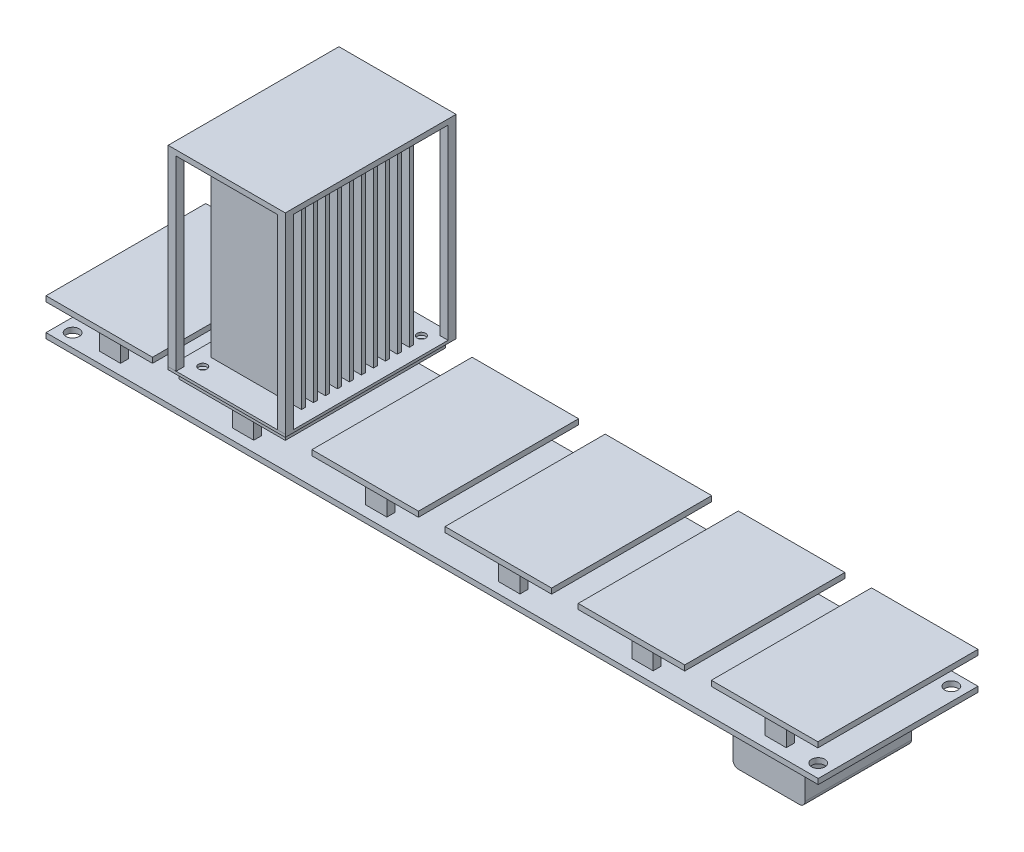
from build123d import *

# Parameters (mm, degrees)
SKIZZE1_W                        = 290
SKIZZE1_H                        = 2
AUFSATZ_LINEAR_AUSTRAGEN1_DEPTH  = 60
SKIZZE2_R                        = 2.5
SCHNITT_LINEAR_AUSTRAGEN1_DEPTH  = 60
SKIZZE3_W                        = 8
SKIZZE3_H                        = 3
AUFSATZ_LINEAR_AUSTRAGEN2_DEPTH  = 10
SKIZZE4_W                        = 40
SKIZZE4_H                        = 60
SKIZZE4_H_2                      = 60.133820733
AUFSATZ_LINEAR_AUSTRAGEN3_DEPTH  = 2
SKIZZE6_W                        = 40
SKIZZE6_H                        = 60.133820733
AUFSATZ_LINEAR_AUSTRAGEN4_DEPTH  = 2
SKIZZE7_W                        = 60.133820733
SKIZZE7_H                        = 2
AUFSATZ_LINEAR_AUSTRAGEN5_DEPTH  = 2
SKIZZE8_W                        = 60.133820733
SKIZZE8_H                        = 2
AUFSATZ_LINEAR_AUSTRAGEN6_DEPTH  = 2
SKIZZE9_W                        = 44
SKIZZE9_H                        = 2
AUFSATZ_LINEAR_AUSTRAGEN7_DEPTH  = 2
SKIZZE10_W                       = 44
SKIZZE10_H                       = 2
AUFSATZ_LINEAR_AUSTRAGEN8_DEPTH  = 2
SKIZZE11_W                       = 34
SKIZZE11_H                       = 1.5
AUFSATZ_LINEAR_AUSTRAGEN9_DEPTH  = 70
SKIZZE12_W                       = 44
SKIZZE12_H                       = 1
SCHNITT_LINEAR_AUSTRAGEN3_DEPTH  = 70
SKIZZE13_W                       = 44
SKIZZE13_H                       = 64.13
AUFSATZ_LINEAR_AUSTRAGEN10_DEPTH = 2
SKIZZE14_W                       = 3
SKIZZE14_H                       = 3
AUFSATZ_LINEAR_AUSTRAGEN11_DEPTH = 72
SKIZZE15_W                       = 27
SKIZZE15_H                       = 40
AUFSATZ_LINEAR_AUSTRAGEN12_DEPTH = 20
VERRUNDUNG2_R                    = 2
VERRUNDUNG3_R                    = 2
SKIZZE18_R                       = 1.6
SCHNITT_LINEAR_AUSTRAGEN4_DEPTH  = 10


with BuildPart() as part:
    # Skizze1 → Aufsatz-Linear austragen1 (new body)
    with BuildSketch(Plane.XY):
        with Locations((145, 1)):
            Rectangle(SKIZZE1_W, SKIZZE1_H)
    extrude(amount=AUFSATZ_LINEAR_AUSTRAGEN1_DEPTH)

    # Skizze2 → Schnitt-Linear austragen1 (cut)
    with BuildSketch(Plane(origin=(0, 2, 0), x_dir=(1, 0, 0), z_dir=(0, 1, 0))):
        with Locations(Location((5, -5, 0), (0, 0, 270))):
            Circle(SKIZZE2_R)
        with Locations(Location((5, -55, 0), (0, 0, 270))):
            Circle(SKIZZE2_R)
        with Locations(Location((285, -55, 0), (0, 0, 270))):
            Circle(SKIZZE2_R)
        with Locations(Location((285, -5, 0), (0, 0, 270))):
            Circle(SKIZZE2_R)
    extrude(amount=-SCHNITT_LINEAR_AUSTRAGEN1_DEPTH, mode=Mode.SUBTRACT)

    # Skizze3 → Aufsatz-Linear austragen2 (add)
    with BuildSketch(Plane(origin=(0, 2, 0), x_dir=(1, 0, 0), z_dir=(0, 1, 0))):
        with Locations((20, -6.5)):
            Rectangle(SKIZZE3_W, SKIZZE3_H)
        with Locations((70, -6.5)):
            Rectangle(SKIZZE3_W, SKIZZE3_H)
        with Locations((120, -6.5)):
            Rectangle(SKIZZE3_W, SKIZZE3_H)
        with Locations((170, -6.5)):
            Rectangle(SKIZZE3_W, SKIZZE3_H)
        with Locations((220, -6.5)):
            Rectangle(SKIZZE3_W, SKIZZE3_H)
        with Locations((270, -6.5)):
            Rectangle(SKIZZE3_W, SKIZZE3_H)
        with Locations((270, -54.5)):
            Rectangle(SKIZZE3_W, SKIZZE3_H)
        with Locations((220, -54.5)):
            Rectangle(SKIZZE3_W, SKIZZE3_H)
        with Locations((170, -54.5)):
            Rectangle(SKIZZE3_W, SKIZZE3_H)
        with Locations((120, -54.5)):
            Rectangle(SKIZZE3_W, SKIZZE3_H)
        with Locations((70, -54.5)):
            Rectangle(SKIZZE3_W, SKIZZE3_H)
        with Locations((20, -54.5)):
            Rectangle(SKIZZE3_W, SKIZZE3_H)
    extrude(amount=AUFSATZ_LINEAR_AUSTRAGEN2_DEPTH)

    # Skizze4 → Aufsatz-Linear austragen3 (add)
    with BuildSketch(Plane(origin=(0, 12, 0), x_dir=(1, 0, 0), z_dir=(0, 1, 0))):
        with Locations((20, -30)):
            Rectangle(SKIZZE4_W, SKIZZE4_H)
        with Locations((70, -30.066910367)):
            Rectangle(SKIZZE4_W, SKIZZE4_H_2)
        with Locations((120, -30.066910367)):
            Rectangle(SKIZZE4_W, SKIZZE4_H_2)
        with Locations((170, -30.066910367)):
            Rectangle(SKIZZE4_W, SKIZZE4_H_2)
        with Locations((220, -30.066910367)):
            Rectangle(SKIZZE4_W, SKIZZE4_H_2)
        with Locations((270, -30.066910367)):
            Rectangle(SKIZZE4_W, SKIZZE4_H_2)
    extrude(amount=AUFSATZ_LINEAR_AUSTRAGEN3_DEPTH)

    # Skizze6 → Aufsatz-Linear austragen4 (add)
    with BuildSketch(Plane(origin=(0, 14, 0), x_dir=(1, 0, 0), z_dir=(0, 1, 0))):
        with Locations((70, -30.066910367)):
            Rectangle(SKIZZE6_W, SKIZZE6_H)
    extrude(amount=AUFSATZ_LINEAR_AUSTRAGEN4_DEPTH)

    # Skizze7 → Aufsatz-Linear austragen5 (add)
    with BuildSketch(Plane(origin=(90, 0, 0), x_dir=(0, 0, -1), z_dir=(1, 0, 0))):
        with Locations((-30.066910367, 15)):
            Rectangle(SKIZZE7_W, SKIZZE7_H)
    extrude(amount=AUFSATZ_LINEAR_AUSTRAGEN5_DEPTH)

    # Skizze8 → Aufsatz-Linear austragen6 (add)
    with BuildSketch(Plane.ZY.offset(-50)):
        with Locations((30.066910367, 15)):
            Rectangle(SKIZZE8_W, SKIZZE8_H)
    extrude(amount=AUFSATZ_LINEAR_AUSTRAGEN6_DEPTH)

    # Skizze9 → Aufsatz-Linear austragen7 (add)
    with BuildSketch(Plane.XY.offset(60.133820733)):
        with Locations((70, 15)):
            Rectangle(SKIZZE9_W, SKIZZE9_H)
    extrude(amount=AUFSATZ_LINEAR_AUSTRAGEN7_DEPTH)

    # Skizze10 → Aufsatz-Linear austragen8 (add)
    with BuildSketch(Plane(origin=(0, 0, 0), x_dir=(-1, 0, 0), z_dir=(0, 0, -1))):
        with Locations((-70, 15)):
            Rectangle(SKIZZE10_W, SKIZZE10_H)
    extrude(amount=AUFSATZ_LINEAR_AUSTRAGEN8_DEPTH)

    # Skizze11 → Aufsatz-Linear austragen9 (add)
    with BuildSketch(Plane(origin=(0, 16, 0), x_dir=(1, 0, 0), z_dir=(0, 1, 0))):
        with Locations((70, -9.815)):
            Rectangle(SKIZZE11_W, SKIZZE11_H)
        with Locations((70, -14.315)):
            Rectangle(SKIZZE11_W, SKIZZE11_H)
        with Locations((70, -18.815)):
            Rectangle(SKIZZE11_W, SKIZZE11_H)
        with Locations((70, -23.315)):
            Rectangle(SKIZZE11_W, SKIZZE11_H)
        with Locations((70, -27.815)):
            Rectangle(SKIZZE11_W, SKIZZE11_H)
        with Locations((70, -32.315)):
            Rectangle(SKIZZE11_W, SKIZZE11_H)
        with Locations((70, -36.815)):
            Rectangle(SKIZZE11_W, SKIZZE11_H)
        with Locations((70, -41.315)):
            Rectangle(SKIZZE11_W, SKIZZE11_H)
        with Locations((70, -45.815)):
            Rectangle(SKIZZE11_W, SKIZZE11_H)
        with Locations((70, -50.315)):
            Rectangle(SKIZZE11_W, SKIZZE11_H)
    extrude(amount=AUFSATZ_LINEAR_AUSTRAGEN9_DEPTH)

    # Skizze12 → Schnitt-Linear austragen3 (cut)
    with BuildSketch(Plane.XY.offset(62.133820733)):
        with Locations((70, 14.5)):
            Rectangle(SKIZZE12_W, SKIZZE12_H)
    extrude(amount=-SCHNITT_LINEAR_AUSTRAGEN3_DEPTH, mode=Mode.SUBTRACT)


with BuildPart() as schnitt_linear_austragen3_piece_1:
    # of the separate pieces the step leaves, piece 1, a body of its own (schnitt_linear_austragen3_pieces)
    add(part.part.solids().sort_by_distance((0, 12, 0))[0])

    # Skizze15 → Aufsatz-Linear austragen12 (add)
    with BuildSketch(Plane.XZ):
        with Locations((261.5, 30)):
            Rectangle(SKIZZE15_W, SKIZZE15_H)
    extrude(amount=AUFSATZ_LINEAR_AUSTRAGEN12_DEPTH)

    # Verrundung2
    verrundung2_edges = [schnitt_linear_austragen3_piece_1.edges().sort_by_distance(p)[0] for p in [
        (275, -20, 30),
    ]]
    fillet(verrundung2_edges, radius=VERRUNDUNG2_R)

    # Verrundung3
    verrundung3_edges = [schnitt_linear_austragen3_piece_1.edges().sort_by_distance(p)[0] for p in [
        (248, -20, 30),
    ]]
    fillet(verrundung3_edges, radius=VERRUNDUNG3_R)


with BuildPart() as schnitt_linear_austragen3_piece_2:
    # of the separate pieces the step leaves, piece 2, a body of its own (schnitt_linear_austragen3_pieces)
    add(part.part.solids().sort_by_distance((92, 15, -2))[0])

    # Skizze13 → Aufsatz-Linear austragen10 (add)
    with BuildSketch(Plane(origin=(0, 86, 0), x_dir=(1, 0, 0), z_dir=(0, 1, 0))):
        with Locations((70, -30.065)):
            Rectangle(SKIZZE13_W, SKIZZE13_H)
    extrude(amount=AUFSATZ_LINEAR_AUSTRAGEN10_DEPTH)

    # Skizze14 → Aufsatz-Linear austragen11 (add)
    with BuildSketch(Plane(origin=(0, 88, 0), x_dir=(1, 0, 0), z_dir=(0, 1, 0))):
        with Locations((49.5, 0.5)):
            Rectangle(SKIZZE14_W, SKIZZE14_H)
        with Locations((90.5, 0.5)):
            Rectangle(SKIZZE14_W, SKIZZE14_H)
        with Locations((90.5, -60.63)):
            Rectangle(SKIZZE14_W, SKIZZE14_H)
        with Locations((49.5, -60.63)):
            Rectangle(SKIZZE14_W, SKIZZE14_H)
    extrude(amount=-AUFSATZ_LINEAR_AUSTRAGEN11_DEPTH)


with BuildPart() as schnitt_linear_austragen4_tool:
    # Skizze18 → Schnitt-Linear austragen4 (new body)
    with BuildSketch(Plane(origin=(0, 16, 0), x_dir=(1, 0, 0), z_dir=(0, 1, 0))):
        with Locations(Location((54.5, -4.5, 0), (0, 0, 270))):
            Circle(SKIZZE18_R)
        with Locations(Location((54.5, -55.633820733, 0), (0, 0, 270))):
            Circle(SKIZZE18_R)
        with Locations(Location((85.5, -55.633820733, 0), (0, 0, 270))):
            Circle(SKIZZE18_R)
        with Locations(Location((85.5, -4.5, 0), (0, 0, 270))):
            Circle(SKIZZE18_R)
    extrude(amount=-SCHNITT_LINEAR_AUSTRAGEN4_DEPTH)


with BuildPart() as schnitt_linear_austragen3_piece_1_1:
    add(schnitt_linear_austragen3_piece_1.part)

    # Schnitt-Linear austragen4: cut by schnitt_linear_austragen4_tool
    add(schnitt_linear_austragen4_tool.part, mode=Mode.SUBTRACT)


with BuildPart() as schnitt_linear_austragen3_piece_2_1:
    add(schnitt_linear_austragen3_piece_2.part)

    # Schnitt-Linear austragen4: cut by schnitt_linear_austragen4_tool
    add(schnitt_linear_austragen4_tool.part, mode=Mode.SUBTRACT)


solid = Compound([schnitt_linear_austragen3_piece_1_1.part, schnitt_linear_austragen3_piece_2_1.part])
